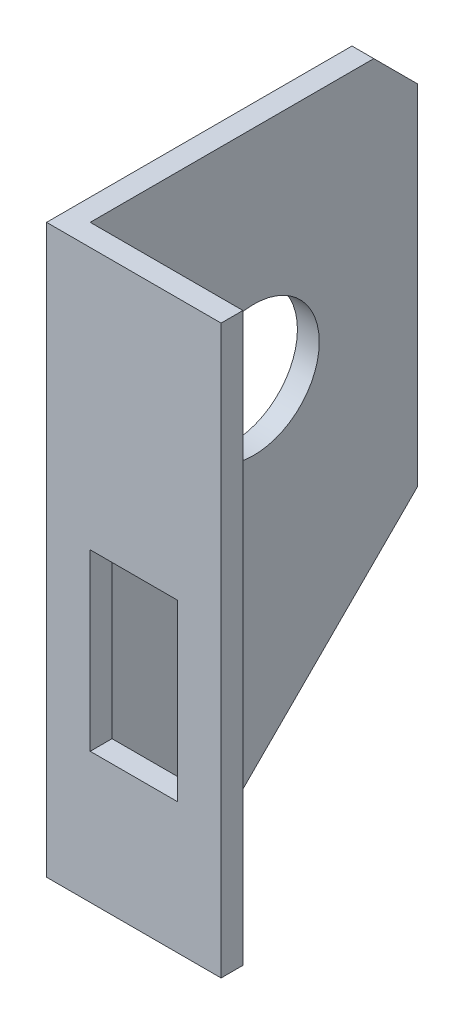
from build123d import *

# Parameters (mm, degrees)
BOSS_EXTRUDE1_DEPTH      = 50.8
BOSS_EXTRUDE1_DEPTH_BACK = 31.75
SKETCH1_W                = 22.225
SKETCH1_H                = 3.175
SKETCH1_W_2              = 3.175
SKETCH1_H_2              = 47.625
SKETCH2_R                = 9.525
CUT_EXTRUDE1_DEPTH       = 3.175
SKETCH3_W                = 12.7
SKETCH3_H                = 25.4
CUT_EXTRUDE2_DEPTH       = 3.175


with BuildPart() as part:
    # Sketch1 → Boss-Extrude1 (new, two sides: drawn at the far end of the back side and taken through both)
    with BuildSketch(Plane(origin=(0, 0, 0), x_dir=(1, 0, 0), z_dir=(0, 1, 0)).offset(-BOSS_EXTRUDE1_DEPTH_BACK)):
        with Locations((1.5875, 0)):
            Rectangle(SKETCH1_W, SKETCH1_H)
        with Locations((-11.1125, 25.4)):
            Rectangle(SKETCH1_W_2, SKETCH1_H_2)
        with Locations((-11.1125, 0)):
            Rectangle(SKETCH1_W_2, SKETCH1_H)
    extrude(amount=BOSS_EXTRUDE1_DEPTH + BOSS_EXTRUDE1_DEPTH_BACK)

    # Sketch2 → Cut-Extrude1 (cut)
    with BuildSketch(Plane(origin=(-9.525, 0, 0), x_dir=(0, 0, -1), z_dir=(1, 0, 0))):
        with Locations((25.4, 19.05)):
            Circle(SKETCH2_R)
        Polygon((42.8625, 50.8), (49.2125, 44.45), (49.2125, 50.8), align=None)
        Polygon((23.8125, -31.75), (49.2125, -31.75), (49.2125, -6.35), align=None)
    extrude(amount=-CUT_EXTRUDE1_DEPTH, mode=Mode.SUBTRACT)

    # Sketch3 → Cut-Extrude2 (cut)
    with BuildSketch(Plane.XY.offset(1.5875)):
        Rectangle(SKETCH3_W, SKETCH3_H)
    extrude(amount=-CUT_EXTRUDE2_DEPTH, mode=Mode.SUBTRACT)


solid = part.part
